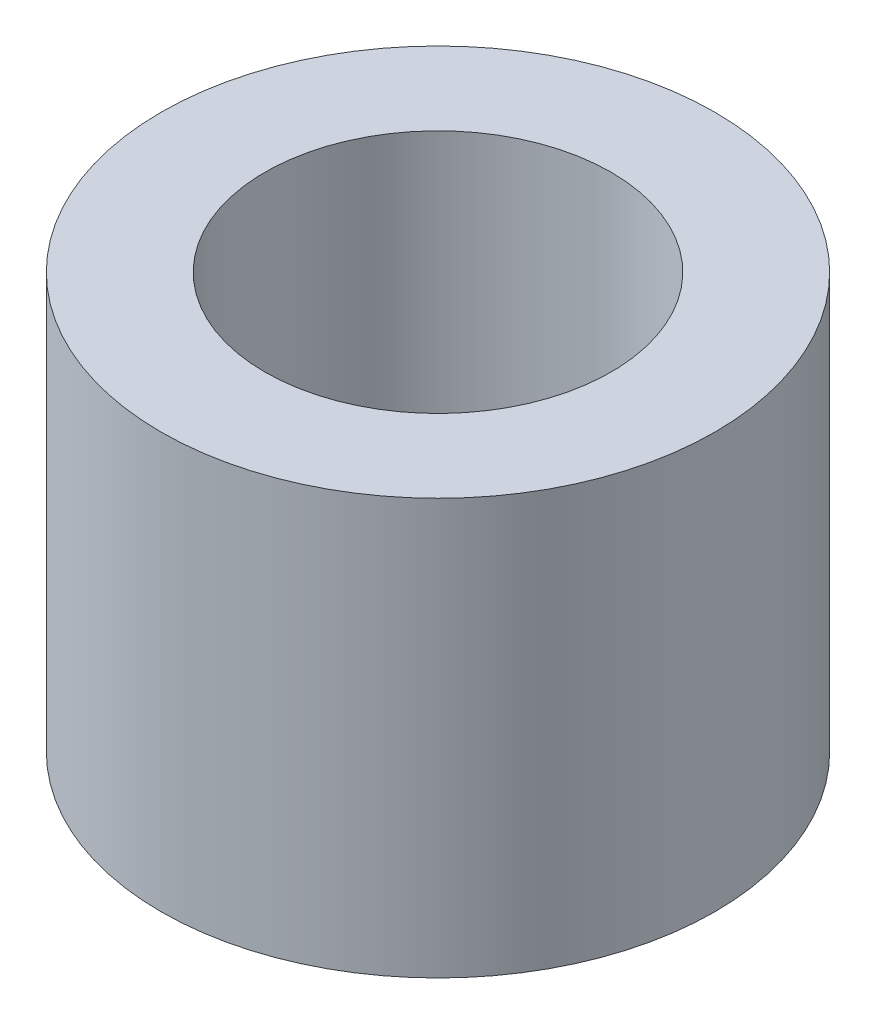
from build123d import *

# Parameters (mm, degrees)
SKETCH1_W = 3
SKETCH1_H = 12


with BuildPart() as part:
    # Sketch1 → Revolve1 (revolve)
    with BuildSketch(Plane.XY, mode=Mode.PRIVATE) as revolve1_sk:
        with Locations((-6.5, 1.161904762)):
            Rectangle(SKETCH1_W, SKETCH1_H)
    revolve(revolve1_sk.sketch.rotate(Axis((0, 10.476190476, 0), (0, -1, 0)), 270), axis=Axis((0, 10.476190476, 0), (0, -1, 0)))


solid = part.part
